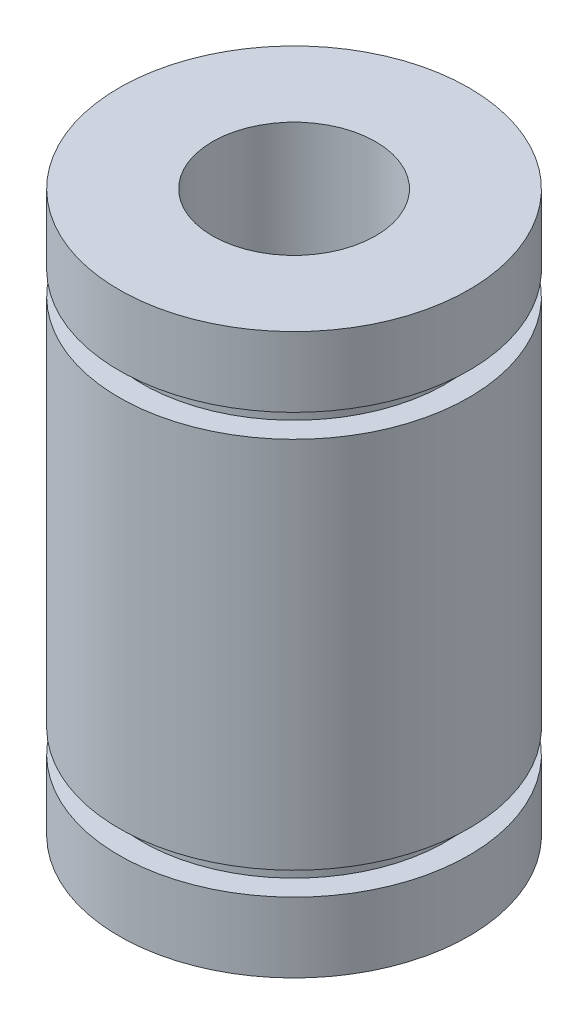
from build123d import *


with BuildPart() as part:
    # Sketch1 → Revolve1 (revolve)
    with BuildSketch(Plane.XY, mode=Mode.PRIVATE) as revolve1_sk:
        Polygon((-3.5, 24), (-3.5, 0), (-7.5, 0), (-7.5, 3), (-6.5, 3), (-6.5, 4), (-7.5, 4), (-7.5, 20), (-6.5, 20), (-6.5, 21), (-7.5, 21), (-7.5, 24), align=None)
    revolve(revolve1_sk.sketch.rotate(Axis((0, 0, 0), (0, 1, 0)), 270), axis=Axis((0, 0, 0), (0, 1, 0)))


solid = part.part
